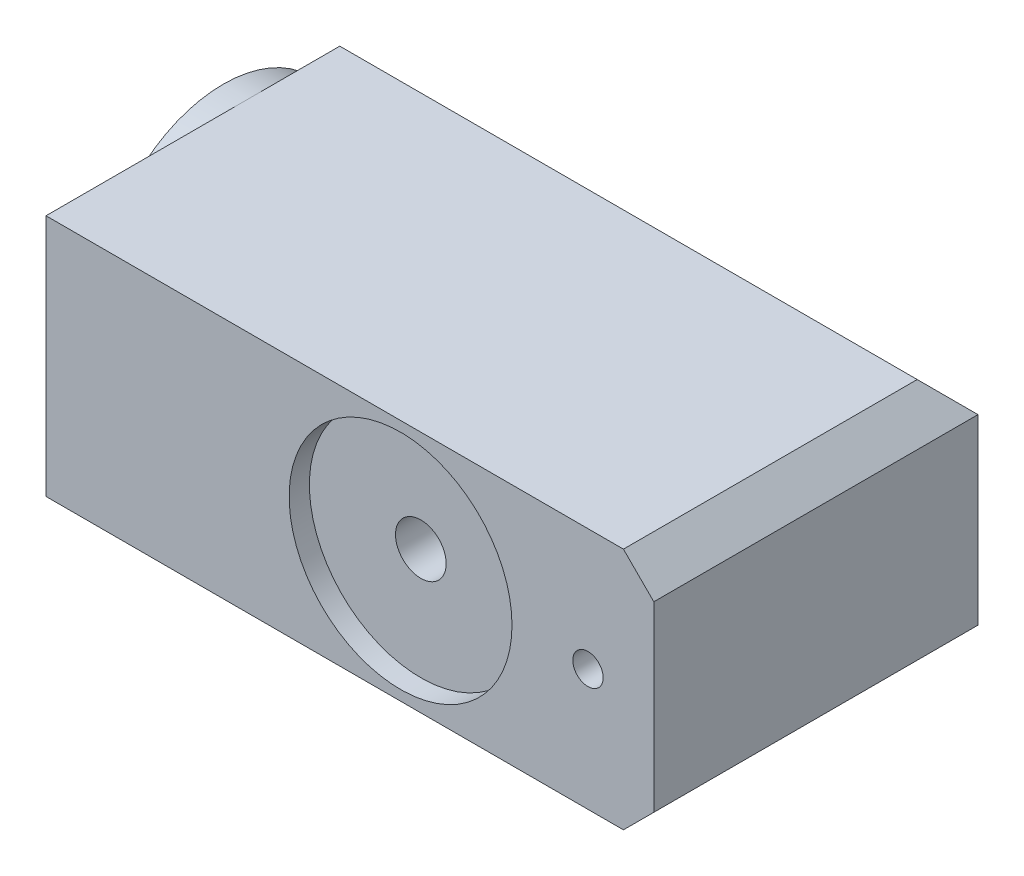
from build123d import *

# Parameters (mm, degrees)
SKETCH1_W             = 60
SKETCH1_H             = 24
BOSS_EXTRUDE1_DEPTH   = 16
CHAMFER1_SIZE         = 3
SKETCH2_R             = 11
CUT_EXTRUDE1_DEPTH    = 2
SKETCH3_R             = 12
SKETCH3_R_2           = 9.5
BOSS_EXTRUDE2_DEPTH   = 2.5
CUT_EXTRUDE2_START    = -53
SKETCH4_R             = 9.5
CUT_EXTRUDE2_DEPTH    = 53
CHAMFER2_SIZE         = 3
SKETCH5_R             = 1.5
CUT_EXTRUDE3_DEPTH    = 12
M6_TAPPED_HOLE1_D     = 5
M6_TAPPED_HOLE1_DEPTH = 12
M6_TAPPED_HOLE1_TIP   = 1.502151548


with BuildPart() as part:
    # Sketch1 → Boss-Extrude1 (new, symmetric)
    with BuildSketch(Plane.XY):
        Rectangle(SKETCH1_W, SKETCH1_H)
    extrude(amount=BOSS_EXTRUDE1_DEPTH, both=True)

    # Chamfer1
    chamfer1_edges = [part.edges().sort_by_distance(p)[0] for p in [
        (30, -12, 0),
        (30, 12, 0),
    ]]
    chamfer(chamfer1_edges, length=CHAMFER1_SIZE)

    # Sketch2 → Cut-Extrude1 (cut)
    with BuildSketch(Plane.XY.offset(16)):
        with Locations((5, 0)):
            Circle(SKETCH2_R)
    extrude(amount=-CUT_EXTRUDE1_DEPTH, mode=Mode.SUBTRACT)

    # Sketch3 → Boss-Extrude2 (add, symmetric)
    with BuildSketch(Plane.ZY.offset(30)):
        with Locations(Location((-4, 0, 0), (0, 0, 270))):
            Circle(SKETCH3_R)
        with Locations(Location((-4, 0, 0), (0, 0, 90))):
            Circle(SKETCH3_R_2, mode=Mode.SUBTRACT)
    extrude(amount=BOSS_EXTRUDE2_DEPTH, both=True)

    # Sketch4 → Cut-Extrude2 (cut)
    with BuildSketch(Plane.ZY.offset(30).offset(CUT_EXTRUDE2_START)):
        with Locations(Location((-4, 0, 0), (0, 0, 270))):
            Circle(SKETCH4_R)
    extrude(amount=CUT_EXTRUDE2_DEPTH, mode=Mode.SUBTRACT)

    # Chamfer2
    chamfer2_edges = [part.edges().sort_by_distance(p)[0] for p in [
        (-1.5, -12, -16),
        (-1.5, 12, -16),
    ]]
    chamfer(chamfer2_edges, length=CHAMFER2_SIZE)

    # Sketch5 → Cut-Extrude3 (cut)
    with BuildSketch(Plane.XY.offset(16)):
        with Locations((23.5, 0)):
            Circle(SKETCH5_R)
    extrude(amount=-CUT_EXTRUDE3_DEPTH, mode=Mode.SUBTRACT)

    # M6 Tapped Hole1
    with Locations(Plane.XY.offset(14)):
        with Locations((5, 0)):
            Hole(M6_TAPPED_HOLE1_D / 2, depth=M6_TAPPED_HOLE1_DEPTH)
            with Locations((0, 0, -(M6_TAPPED_HOLE1_DEPTH + M6_TAPPED_HOLE1_TIP / 2))):  # 118° drill point
                Cone(0, M6_TAPPED_HOLE1_D / 2, M6_TAPPED_HOLE1_TIP, mode=Mode.SUBTRACT)


solid = part.part
